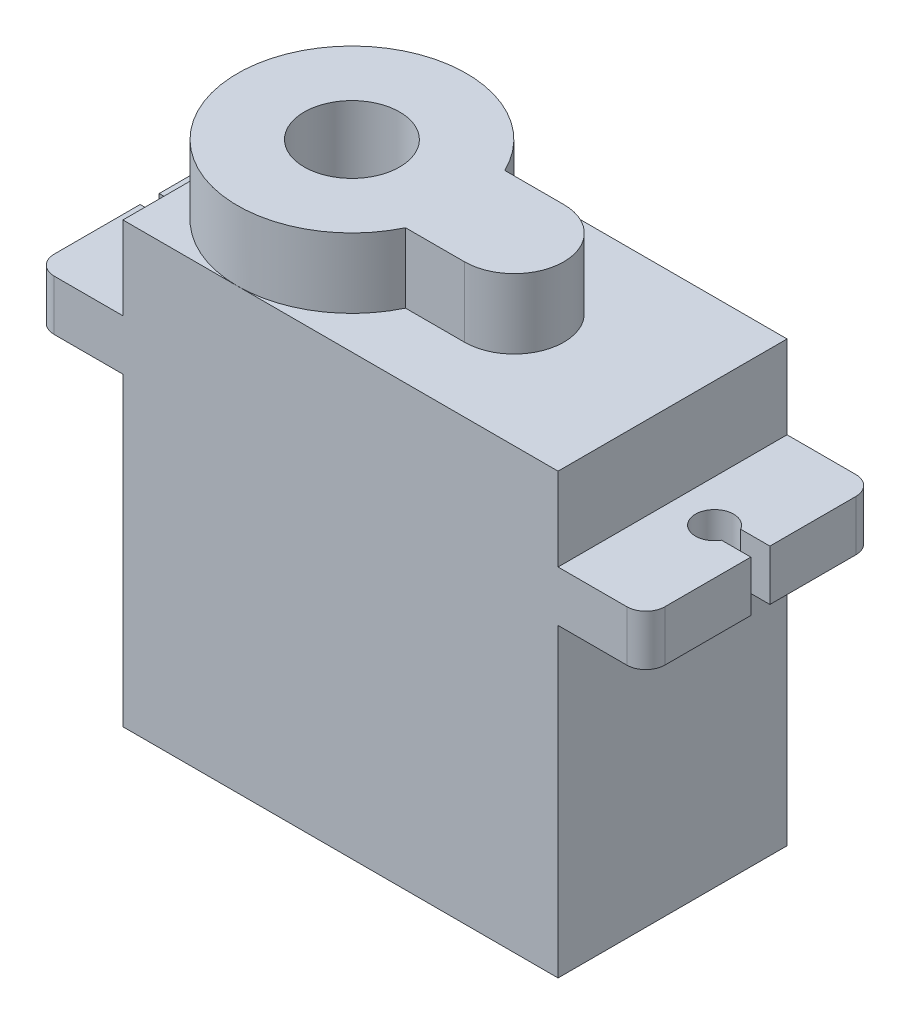
from build123d import *

# Parameters (mm, degrees)
SKETCH1_W                       = 22.8
SKETCH1_H                       = 12
BOSS_EXTRUDE1_DEPTH             = 16
SKETCH2_W                       = 32
SKETCH2_H                       = 12
BOSS_EXTRUDE2_DEPTH             = 2.65
BOSS_EXTRUDE3_REACH             = 25.409
SKETCH3_W                       = 22.8
SKETCH3_H                       = 23
BOSS_EXTRUDE3_DIRECTION_2_REACH = 25.409
CUT_EXTRUDE1_REACH              = 27.295
FILLET1_R                       = 1
SKETCH5_R                       = 6
BOSS_EXTRUDE4_DEPTH             = 3.65
BOSS_EXTRUDE5_DEPTH             = 3.65
SKETCH7_R                       = 2.5
CUT_EXTRUDE2_DEPTH              = 3.65
SKETCH8_W                       = 3
SKETCH8_H                       = 1
BOSS_EXTRUDE6_DEPTH             = 3


with BuildPart() as part:
    # Sketch1 → Boss-Extrude1 (new body)
    with BuildSketch(Plane(origin=(0, 0, 0), x_dir=(1, 0, 0), z_dir=(0, 1, 0))):
        Rectangle(SKETCH1_W, SKETCH1_H)
    extrude(amount=-BOSS_EXTRUDE1_DEPTH)

    # Sketch2 → Boss-Extrude2 (add)
    with BuildSketch(Plane(origin=(0, 0, 0), x_dir=(1, 0, 0), z_dir=(0, 1, 0))):
        Rectangle(SKETCH2_W, SKETCH2_H)
    extrude(amount=BOSS_EXTRUDE2_DEPTH)

    # Boss-Extrude3: up to this face of the body (flat: up to its plane)
    boss_extrude3_end = Plane(part.part.faces().sort_by_distance((0, -6.241192171, 6))[0])
    # Sketch3 → Boss-Extrude3 (add, up to the picked face)
    with BuildSketch(Plane.XY, mode=Mode.PRIVATE) as boss_extrude3_sk1:
        with Locations((0, -4.5)):
            Rectangle(SKETCH3_W, SKETCH3_H)
    boss_extrude3_tool1 = split(extrude(boss_extrude3_sk1.sketch, amount=BOSS_EXTRUDE3_REACH, mode=Mode.PRIVATE), bisect_by=boss_extrude3_end, keep=Keep.BOTH, mode=Mode.PRIVATE)
    add(boss_extrude3_tool1.solids().sort_by(Axis((0, -4.5, 0), (0, 0, 1)))[0])

    # Boss-Extrude3 direction 2: up to this face of the body (flat: up to its plane)
    boss_extrude3_direction_2_end = Plane(part.part.faces().sort_by_distance((0, -6.241192171, -6))[0])
    # Sketch3 → Boss-Extrude3 direction 2 (add, up to the picked face)
    with BuildSketch(Plane.XY, mode=Mode.PRIVATE) as boss_extrude3_direction_2_sk1:
        with Locations((0, -4.5)):
            Rectangle(SKETCH3_W, SKETCH3_H)
    boss_extrude3_direction_2_tool1 = split(extrude(boss_extrude3_direction_2_sk1.sketch, amount=-BOSS_EXTRUDE3_DIRECTION_2_REACH, mode=Mode.PRIVATE), bisect_by=boss_extrude3_direction_2_end, keep=Keep.BOTH, mode=Mode.PRIVATE)
    add(boss_extrude3_direction_2_tool1.solids().sort_by(Axis((0, -4.5, 0), (0, 0, -1)))[0])

    # Sketch4 → Cut-Extrude1 (cut, up to next)
    with BuildSketch(Plane(origin=(0, 2.65, 0), x_dir=(1, 0, 0), z_dir=(0, 1, 0)), mode=Mode.PRIVATE) as cut_extrude1_sk1:
        with BuildLine():
            ThreePointArc((14.6, 0), (14.565925826, 0.258819045), (14.466025404, 0.5))
            Line((14.466025404, 0.5), (13.6, 0.5))
            Line((13.6, 0.5), (13.6, -0.5))
            Line((13.6, -0.5), (14.466025404, -0.5))
            ThreePointArc((14.466025404, -0.5), (14.565925826, -0.258819045), (14.6, 0))
        make_face()
    cut_extrude1_tool1 = extrude(cut_extrude1_sk1.sketch, amount=-CUT_EXTRUDE1_REACH, mode=Mode.PRIVATE) & part.part
    # Sketch4 → Cut-Extrude1 (cut, up to next)
    with BuildSketch(Plane(origin=(0, 2.65, 0), x_dir=(1, 0, 0), z_dir=(0, 1, 0)), mode=Mode.PRIVATE) as cut_extrude1_sk2:
        with BuildLine():
            Line((13.6, 0.5), (14.466025404, 0.5))
            ThreePointArc((14.466025404, 0.5), (12.6, 0), (14.466025404, -0.5))
            Line((14.466025404, -0.5), (13.6, -0.5))
            Line((13.6, -0.5), (13.6, 0.5))
        make_face()
    cut_extrude1_tool2 = extrude(cut_extrude1_sk2.sketch, amount=-CUT_EXTRUDE1_REACH, mode=Mode.PRIVATE) & part.part
    # Sketch4 → Cut-Extrude1 (cut, up to next)
    with BuildSketch(Plane(origin=(0, 2.65, 0), x_dir=(1, 0, 0), z_dir=(0, 1, 0)), mode=Mode.PRIVATE) as cut_extrude1_sk3:
        with BuildLine():
            ThreePointArc((14.6, 0), (14.565925826, 0.258819045), (14.466025404, 0.5))
            Line((14.466025404, 0.5), (13.6, 0.5))
            Line((13.6, 0.5), (13.6, -0.5))
            Line((13.6, -0.5), (14.466025404, -0.5))
            ThreePointArc((14.466025404, -0.5), (14.565925826, -0.258819045), (14.6, 0))
        make_face()
    cut_extrude1_tool3 = extrude(cut_extrude1_sk3.sketch, amount=-CUT_EXTRUDE1_REACH, mode=Mode.PRIVATE) & part.part
    # Sketch4 → Cut-Extrude1 (cut, up to next)
    with BuildSketch(Plane(origin=(0, 2.65, 0), x_dir=(1, 0, 0), z_dir=(0, 1, 0)), mode=Mode.PRIVATE) as cut_extrude1_sk4:
        with BuildLine():
            Line((13.6, 0.5), (14.466025404, 0.5))
            ThreePointArc((14.466025404, 0.5), (12.6, 0), (14.466025404, -0.5))
            Line((14.466025404, -0.5), (13.6, -0.5))
            Line((13.6, -0.5), (13.6, 0.5))
        make_face()
    cut_extrude1_tool4 = extrude(cut_extrude1_sk4.sketch, amount=-CUT_EXTRUDE1_REACH, mode=Mode.PRIVATE) & part.part
    # Sketch4 → Cut-Extrude1 (cut, up to next)
    with BuildSketch(Plane(origin=(0, 2.65, 0), x_dir=(1, 0, 0), z_dir=(0, 1, 0)), mode=Mode.PRIVATE) as cut_extrude1_sk5:
        with BuildLine():
            Line((16, -0.5), (16, 0.5))
            Line((16, 0.5), (14.466025404, 0.5))
            ThreePointArc((14.466025404, 0.5), (14.565925826, 0.258819045), (14.6, 0))
            ThreePointArc((14.6, 0), (14.565925826, -0.258819045), (14.466025404, -0.5))
            Line((14.466025404, -0.5), (16, -0.5))
        make_face()
    cut_extrude1_tool5 = extrude(cut_extrude1_sk5.sketch, amount=-CUT_EXTRUDE1_REACH, mode=Mode.PRIVATE) & part.part
    # Sketch4 → Cut-Extrude1 (cut, up to next)
    with BuildSketch(Plane(origin=(0, 2.65, 0), x_dir=(1, 0, 0), z_dir=(0, 1, 0)), mode=Mode.PRIVATE) as cut_extrude1_sk6:
        with BuildLine():
            Line((-14.466025404, 0.5), (-16, 0.5))
            Line((-16, 0.5), (-16, -0.5))
            Line((-16, -0.5), (-14.466025404, -0.5))
            ThreePointArc((-14.466025404, -0.5), (-14.6, 0), (-14.466025404, 0.5))
        make_face()
    cut_extrude1_tool6 = extrude(cut_extrude1_sk6.sketch, amount=-CUT_EXTRUDE1_REACH, mode=Mode.PRIVATE) & part.part
    # Sketch4 → Cut-Extrude1 (cut, up to next)
    with BuildSketch(Plane(origin=(0, 2.65, 0), x_dir=(1, 0, 0), z_dir=(0, 1, 0)), mode=Mode.PRIVATE) as cut_extrude1_sk7:
        with BuildLine():
            ThreePointArc((-12.6, 0), (-13.341180955, 0.965925826), (-14.466025404, 0.5))
            Line((-14.466025404, 0.5), (-13.6, 0.5))
            Line((-13.6, 0.5), (-13.6, -0.5))
            Line((-13.6, -0.5), (-14.466025404, -0.5))
            ThreePointArc((-14.466025404, -0.5), (-13.341180955, -0.965925826), (-12.6, 0))
        make_face()
    cut_extrude1_tool7 = extrude(cut_extrude1_sk7.sketch, amount=-CUT_EXTRUDE1_REACH, mode=Mode.PRIVATE) & part.part
    # Sketch4 → Cut-Extrude1 (cut, up to next)
    with BuildSketch(Plane(origin=(0, 2.65, 0), x_dir=(1, 0, 0), z_dir=(0, 1, 0)), mode=Mode.PRIVATE) as cut_extrude1_sk8:
        with BuildLine():
            Line((-13.6, 0.5), (-14.466025404, 0.5))
            ThreePointArc((-14.466025404, 0.5), (-14.6, 0), (-14.466025404, -0.5))
            Line((-14.466025404, -0.5), (-13.6, -0.5))
            Line((-13.6, -0.5), (-13.6, 0.5))
        make_face()
    cut_extrude1_tool8 = extrude(cut_extrude1_sk8.sketch, amount=-CUT_EXTRUDE1_REACH, mode=Mode.PRIVATE) & part.part
    # Sketch4 → Cut-Extrude1 (cut, up to next)
    with BuildSketch(Plane(origin=(0, 2.65, 0), x_dir=(1, 0, 0), z_dir=(0, 1, 0)), mode=Mode.PRIVATE) as cut_extrude1_sk9:
        with BuildLine():
            ThreePointArc((-12.6, 0), (-13.341180955, 0.965925826), (-14.466025404, 0.5))
            Line((-14.466025404, 0.5), (-13.6, 0.5))
            Line((-13.6, 0.5), (-13.6, -0.5))
            Line((-13.6, -0.5), (-14.466025404, -0.5))
            ThreePointArc((-14.466025404, -0.5), (-13.341180955, -0.965925826), (-12.6, 0))
        make_face()
    cut_extrude1_tool9 = extrude(cut_extrude1_sk9.sketch, amount=-CUT_EXTRUDE1_REACH, mode=Mode.PRIVATE) & part.part
    # Sketch4 → Cut-Extrude1 (cut, up to next)
    with BuildSketch(Plane(origin=(0, 2.65, 0), x_dir=(1, 0, 0), z_dir=(0, 1, 0)), mode=Mode.PRIVATE) as cut_extrude1_sk10:
        with BuildLine():
            Line((-13.6, 0.5), (-14.466025404, 0.5))
            ThreePointArc((-14.466025404, 0.5), (-14.6, 0), (-14.466025404, -0.5))
            Line((-14.466025404, -0.5), (-13.6, -0.5))
            Line((-13.6, -0.5), (-13.6, 0.5))
        make_face()
    cut_extrude1_tool10 = extrude(cut_extrude1_sk10.sketch, amount=-CUT_EXTRUDE1_REACH, mode=Mode.PRIVATE) & part.part
    add(cut_extrude1_tool1.solids().sort_by_distance((14.079122, 2.65, 0))[0], mode=Mode.SUBTRACT)
    add(cut_extrude1_tool2.solids().sort_by_distance((13.390235, 2.65, 0))[0], mode=Mode.SUBTRACT)
    add(cut_extrude1_tool3.solids().sort_by_distance((14.079122, 2.65, 0))[0], mode=Mode.SUBTRACT)
    add(cut_extrude1_tool4.solids().sort_by_distance((13.390235, 2.65, 0))[0], mode=Mode.SUBTRACT)
    add(cut_extrude1_tool5.solids().sort_by_distance((15.277765, 2.65, 0))[0], mode=Mode.SUBTRACT)
    add(cut_extrude1_tool6.solids().sort_by_distance((-15.277765, 2.65, 0))[0], mode=Mode.SUBTRACT)
    add(cut_extrude1_tool7.solids().sort_by_distance((-13.390235, 2.65, 0))[0], mode=Mode.SUBTRACT)
    add(cut_extrude1_tool8.solids().sort_by_distance((-14.079122, 2.65, 0))[0], mode=Mode.SUBTRACT)
    add(cut_extrude1_tool9.solids().sort_by_distance((-13.390235, 2.65, 0))[0], mode=Mode.SUBTRACT)
    add(cut_extrude1_tool10.solids().sort_by_distance((-14.079122, 2.65, 0))[0], mode=Mode.SUBTRACT)

    # Fillet1
    fillet1_edges = [part.edges().sort_by_distance(p)[0] for p in [
        (16, 1.325, 6),
        (16, 1.325, -6),
        (-16, 1.325, -6),
        (-16, 1.325, 6),
    ]]
    fillet(fillet1_edges, radius=FILLET1_R)

    # Sketch5 → Boss-Extrude4 (add)
    with BuildSketch(Plane(origin=(0, 7, 0), x_dir=(1, 0, 0), z_dir=(0, 1, 0))):
        with Locations(Location((-5.4, 0, 0), (0, 0, 270))):
            Circle(SKETCH5_R)
    extrude(amount=BOSS_EXTRUDE4_DEPTH)

    # Sketch6 → Boss-Extrude5 (add)
    with BuildSketch(Plane(origin=(0, 7, 0), x_dir=(1, 0, 0), z_dir=(0, 1, 0))):
        with BuildLine():
            Line((0.007402334, -2.6), (3.1, -2.6))
            ThreePointArc((3.1, -2.6), (1.487245955, -2.039368625), (0.57, -0.599249531))
            ThreePointArc((0.57, -0.599249531), (0.375990961, -1.624170072), (0.007402334, -2.6))
        make_face()
        with BuildLine():
            ThreePointArc((0.57, 0.599249531), (1.487245955, 2.039368625), (3.1, 2.6))
            Line((3.1, 2.6), (0.007402334, 2.6))
            ThreePointArc((0.007402334, 2.6), (0.375990961, 1.624170072), (0.57, 0.599249531))
        make_face()
        with BuildLine():
            ThreePointArc((5.7, 0), (4.938477631, 1.838477631), (3.1, 2.6))
            ThreePointArc((3.1, 2.6), (1.487245955, 2.039368625), (0.57, 0.599249531))
            ThreePointArc((0.57, 0.599249531), (0.592495307, 0.3), (0.6, 0))
            ThreePointArc((0.6, 0), (0.592495307, -0.3), (0.57, -0.599249531))
            ThreePointArc((0.57, -0.599249531), (1.487245955, -2.039368625), (3.1, -2.6))
            ThreePointArc((3.1, -2.6), (4.938477631, -1.838477631), (5.7, 0))
        make_face()
        with BuildLine():
            ThreePointArc((0.6, 0), (0.592495307, 0.3), (0.57, 0.599249531))
            ThreePointArc((0.57, 0.599249531), (0.5, 0), (0.57, -0.599249531))
            ThreePointArc((0.57, -0.599249531), (0.592495307, -0.3), (0.6, 0))
        make_face()
    extrude(amount=BOSS_EXTRUDE5_DEPTH)

    # Sketch7 → Cut-Extrude2 (cut)
    with BuildSketch(Plane(origin=(0, 10.65, 0), x_dir=(1, 0, 0), z_dir=(0, 1, 0))):
        with Locations(Location((-5.4, 0, 0), (0, 0, 270))):
            Circle(SKETCH7_R)
    extrude(amount=-CUT_EXTRUDE2_DEPTH, mode=Mode.SUBTRACT)

    # Sketch8 → Boss-Extrude6 (add)
    with BuildSketch(Plane.ZY.offset(11.4)):
        with Locations((0, -10.1)):
            Rectangle(SKETCH8_W, SKETCH8_H)
    extrude(amount=BOSS_EXTRUDE6_DEPTH)


solid = part.part
